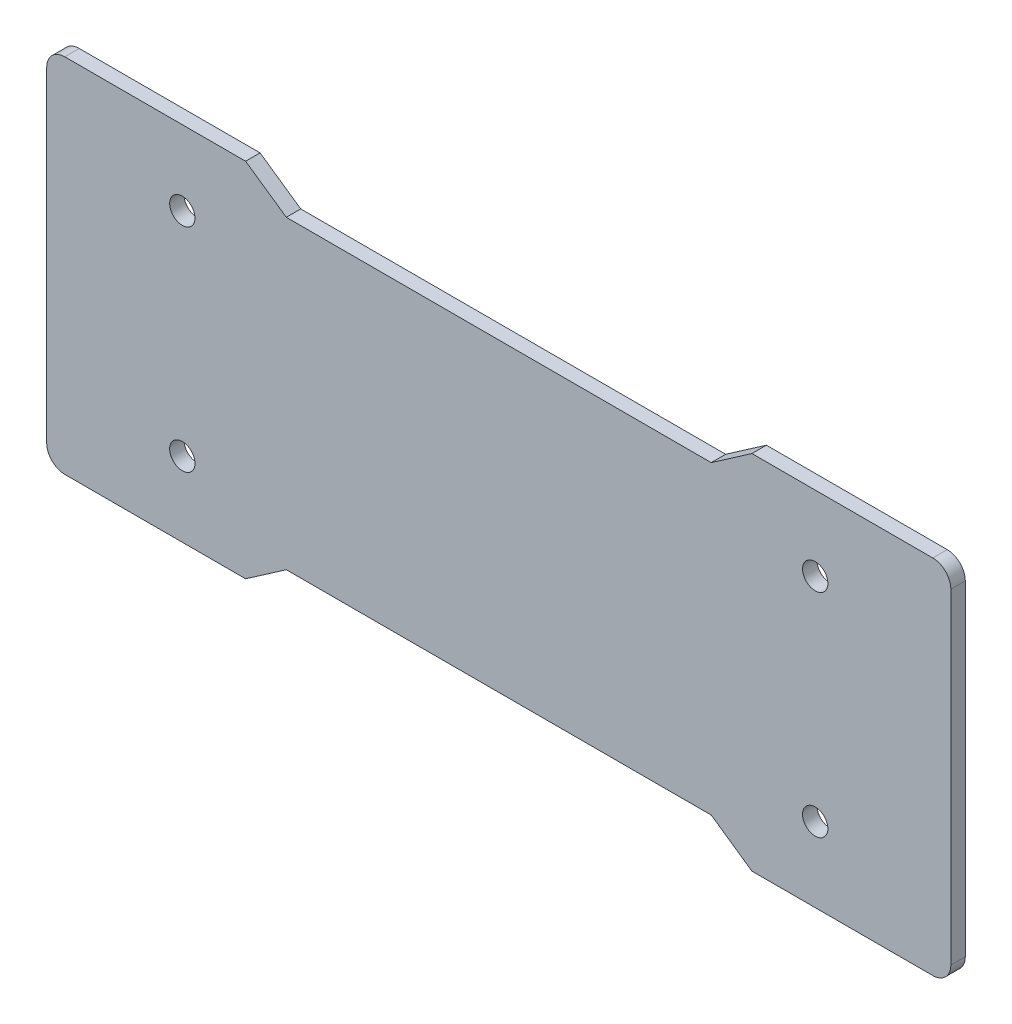
from build123d import *

# Parameters (mm, degrees)
BOSS_EXTRUDE1_DEPTH = 1.6
SKETCH2_R           = 1.4
CUT_EXTRUDE1_DEPTH  = 1.6


with BuildPart() as part:
    # Sketch1 → Boss-Extrude1 (new body)
    with BuildSketch(Plane.XY):
        with BuildLine():
            Line((48, -20), (-48, -20))
            ThreePointArc((-48, -20), (-49.414213562, -19.414213562), (-50, -18))
            Line((-50, -18), (-50, 18))
            ThreePointArc((-50, 18), (-49.414213562, 19.414213562), (-48, 20))
            Line((-48, 20), (48, 20))
            ThreePointArc((48, 20), (49.414213562, 19.414213562), (50, 18))
            Line((50, 18), (50, -18))
            ThreePointArc((50, -18), (49.414213562, -19.414213562), (48, -20))
        make_face()
    extrude(amount=BOSS_EXTRUDE1_DEPTH)

    # Sketch2 → Cut-Extrude1 (cut)
    with BuildSketch(Plane.XY.offset(1.6)):
        with Locations((-35, 11.75)):
            Circle(SKETCH2_R)
        with Locations(Location((-35, -11.75, 0), (0, 0, 180))):
            Circle(SKETCH2_R)
        with Locations((35, -11.75)):
            Circle(SKETCH2_R)
        with Locations(Location((35, 11.75, 0), (0, 0, 180))):
            Circle(SKETCH2_R)
        Polygon((23.5, 16.88), (-23.5, 16.88), (-28, 20), (28, 20), align=None)
        Polygon((28, -20), (23.5, -16.88), (-23.5, -16.88), (-28, -20), align=None)
    extrude(amount=-CUT_EXTRUDE1_DEPTH, mode=Mode.SUBTRACT)


solid = part.part
